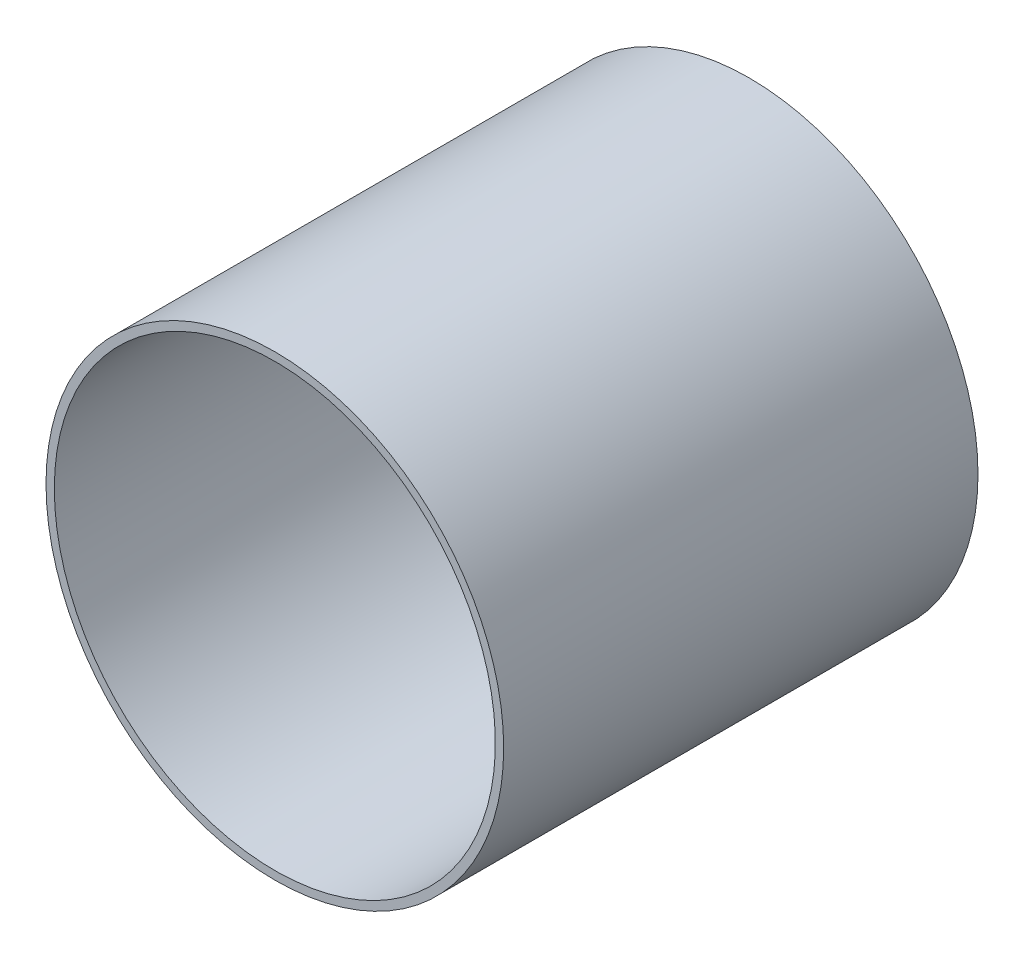
from build123d import *

# Parameters (mm, degrees)
ESQUISSE1_R      = 27.5
ESQUISSE1_R_2    = 26.5
EXTRUSION1_DEPTH = 57


with BuildPart() as part:
    # Esquisse1 → Extrusion1 (new body)
    with BuildSketch(Plane.XY):
        with Locations(Location((0, 0, 0), (0, 0, 180))):
            Circle(ESQUISSE1_R)
        with Locations(Location((0, 0, 0), (0, 0, 180))):
            Circle(ESQUISSE1_R_2, mode=Mode.SUBTRACT)
    extrude(amount=EXTRUSION1_DEPTH)


solid = part.part
